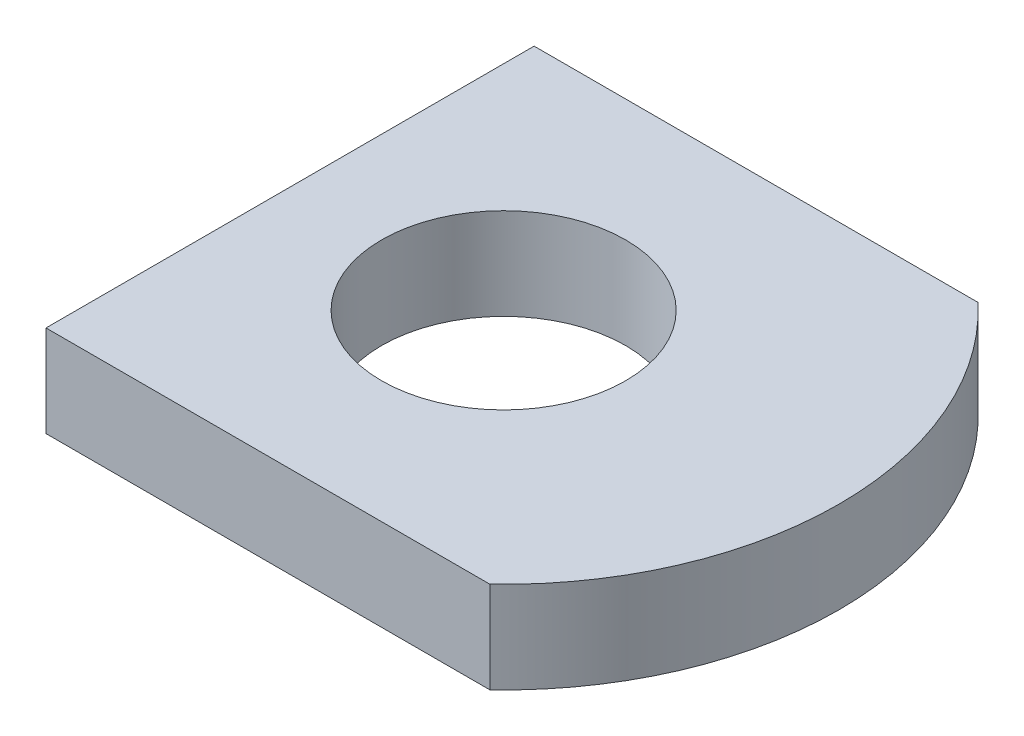
from build123d import *

# Parameters (mm, degrees)
CROQUIS1_R              = 4
SALIENTE_EXTRUIR1_DEPTH = 3


with BuildPart() as part:
    # Croquis1 → Saliente-Extruir1 (new body)
    with BuildSketch(Plane(origin=(0, 0, 0), x_dir=(1, 0, 0), z_dir=(0, 1, 0))):
        with BuildLine():
            Line((0, 0), (14.549834435, 0))
            ThreePointArc((14.549834435, 0), (18, 8), (14.549834435, 16))
            Line((14.549834435, 16), (0, 16))
            Line((0, 16), (0, 0))
        make_face()
        with Locations(Location((7, 8, 0), (0, 0, 270))):
            Circle(CROQUIS1_R, mode=Mode.SUBTRACT)
    extrude(amount=SALIENTE_EXTRUIR1_DEPTH)


solid = part.part
